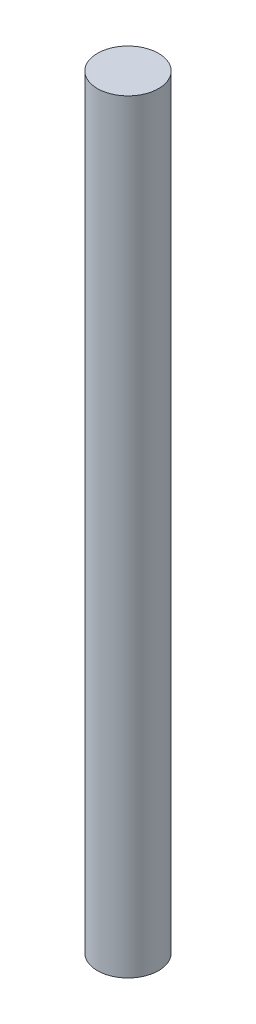
from build123d import *

# Parameters (mm, degrees)
SKETCH1_R           = 0.5
BOSS_EXTRUDE1_DEPTH = 12.5


with BuildPart() as part:
    # Sketch1 → Boss-Extrude1 (new body)
    with BuildSketch(Plane(origin=(0, 0, 0), x_dir=(1, 0, 0), z_dir=(0, 1, 0))):
        with Locations(Location((0, 0, 0), (0, 0, 270))):
            Circle(SKETCH1_R)
    extrude(amount=BOSS_EXTRUDE1_DEPTH)


solid = part.part
